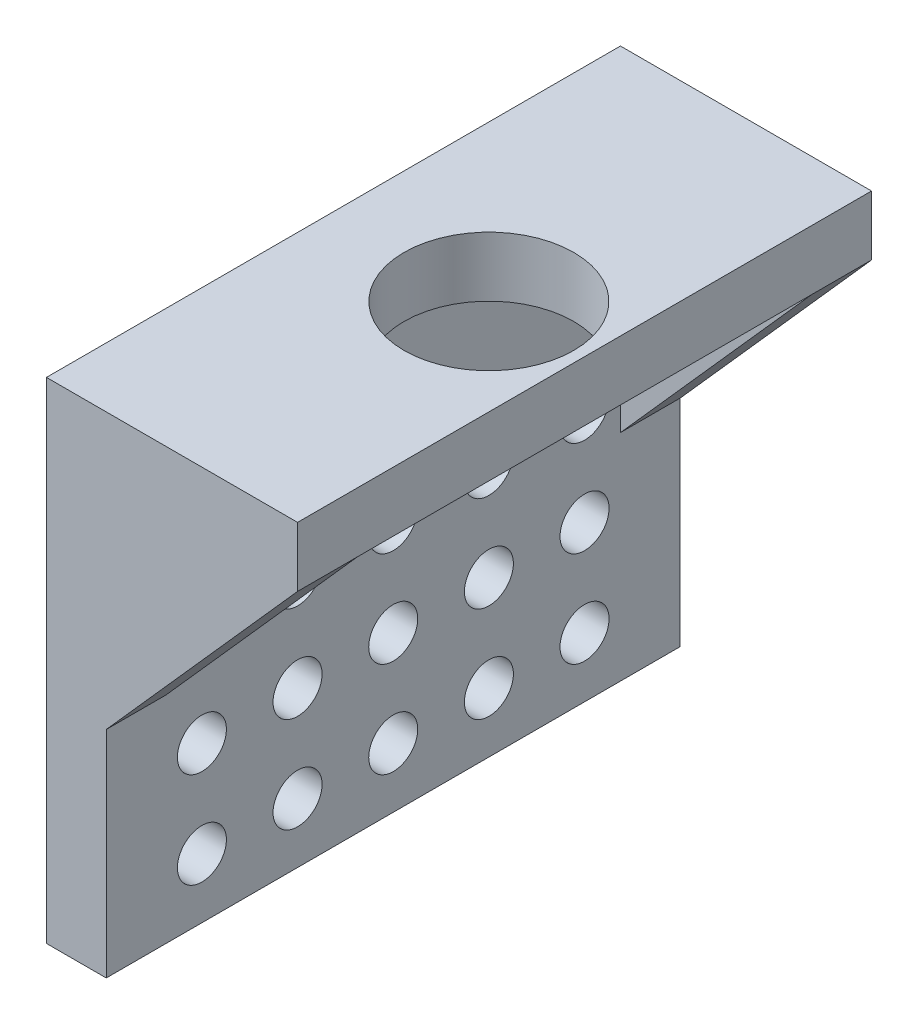
from build123d import *

# Parameters (mm, degrees)
SKETCH1_W           = 21
SKETCH1_H           = 48
SKETCH1_R           = 7.1
BOSS_EXTRUDE1_DEPTH = 5
SKETCH2_W           = 5
SKETCH2_H           = 48
BOSS_EXTRUDE2_DEPTH = 36
SKETCH4_W           = 16
SKETCH4_H           = 5
BOSS_EXTRUDE3_DEPTH = 18
CUT_EXTRUDE1_DEPTH  = 64.568860301
SKETCH6_R           = 2.05
CUT_EXTRUDE2_DEPTH  = 18


with BuildPart() as part:
    # Sketch1 → Boss-Extrude1 (new body)
    with BuildSketch(Plane(origin=(0, 0, 0), x_dir=(1, 0, 0), z_dir=(0, 1, 0))):
        with Locations((10.5, -24)):
            Rectangle(SKETCH1_W, SKETCH1_H)
        with Locations(Location((13, -24, 0), (0, 0, 270))):
            Circle(SKETCH1_R, mode=Mode.SUBTRACT)
    extrude(amount=BOSS_EXTRUDE1_DEPTH)

    # Sketch2 → Boss-Extrude2 (add)
    with BuildSketch(Plane.XZ):
        with Locations((2.5, 24)):
            Rectangle(SKETCH2_W, SKETCH2_H)
    extrude(amount=BOSS_EXTRUDE2_DEPTH)

    # Sketch4 → Boss-Extrude3 (add)
    with BuildSketch(Plane.XZ):
        with Locations((13, 45.5)):
            Rectangle(SKETCH4_W, SKETCH4_H)
        with Locations((13, 2.5)):
            Rectangle(SKETCH4_W, SKETCH4_H)
    extrude(amount=BOSS_EXTRUDE3_DEPTH)

    # Sketch5 → Cut-Extrude1 (cut, through all)
    with BuildSketch(Plane.XY.offset(48)):
        Polygon((21, 0), (5, -18), (21, -18), align=None)
    extrude(amount=-CUT_EXTRUDE1_DEPTH, mode=Mode.SUBTRACT)

    # Sketch6 → Cut-Extrude2 (cut)
    with BuildSketch(Plane.ZY):
        with Locations((8, -31)):
            Circle(SKETCH6_R)
        with Locations((16, -31)):
            Circle(SKETCH6_R)
        with Locations((24, -31)):
            Circle(SKETCH6_R)
        with Locations((32, -31)):
            Circle(SKETCH6_R)
        with Locations((40, -31)):
            Circle(SKETCH6_R)
        with Locations((16, -23)):
            Circle(SKETCH6_R)
        with Locations((24, -23)):
            Circle(SKETCH6_R)
        with Locations((32, -23)):
            Circle(SKETCH6_R)
        with Locations((40, -23)):
            Circle(SKETCH6_R)
        with Locations((16, -15)):
            Circle(SKETCH6_R)
        with Locations((24, -15)):
            Circle(SKETCH6_R)
        with Locations((32, -15)):
            Circle(SKETCH6_R)
        with Locations((40, -15)):
            Circle(SKETCH6_R)
        with Locations((8, -23)):
            Circle(SKETCH6_R)
        with Locations((8, -15)):
            Circle(SKETCH6_R)
    extrude(amount=-CUT_EXTRUDE2_DEPTH, mode=Mode.SUBTRACT)


solid = part.part
